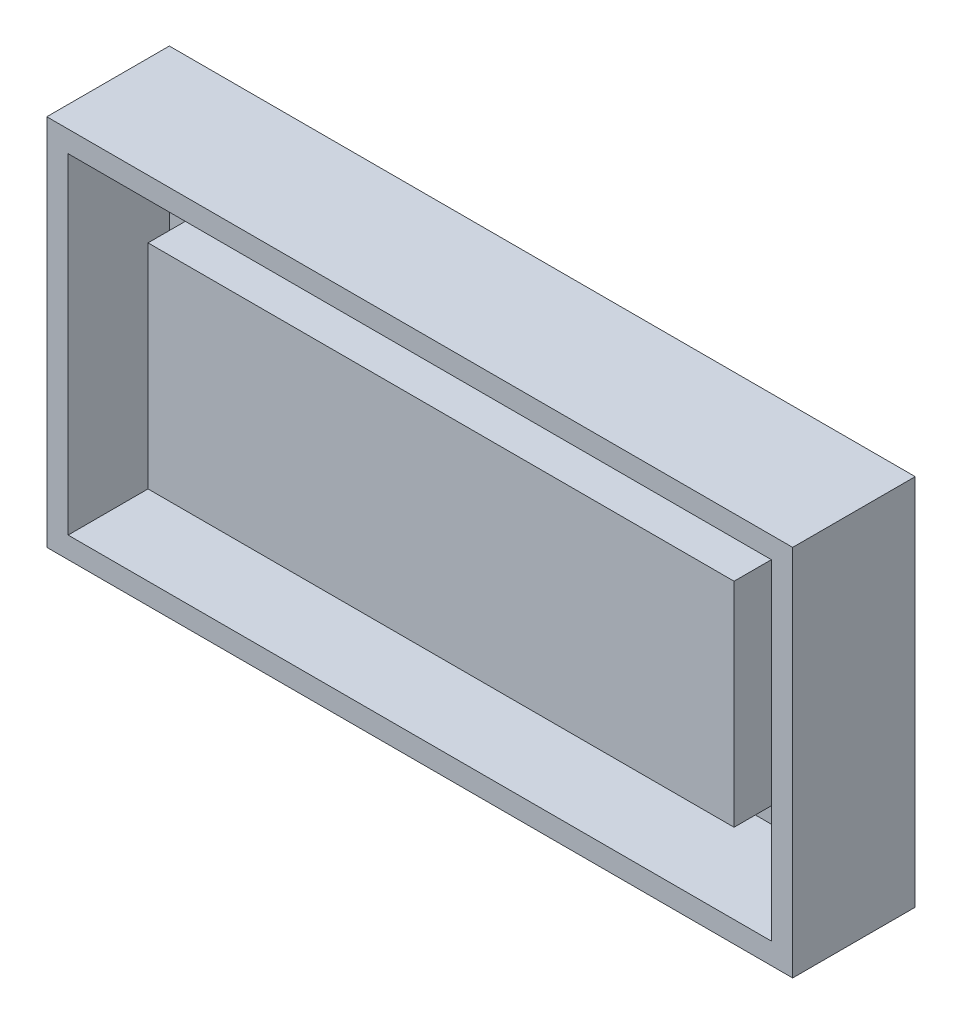
from build123d import *

# Parameters (mm, degrees)
SKETCH1_W           = 70
SKETCH1_H           = 35
BOSS_EXTRUDE1_DEPTH = 2
SKETCH1_3_W         = 70
SKETCH1_3_H         = 35
SKETCH1_3_W_2       = 66
SKETCH1_3_H_2       = 31
BOSS_EXTRUDE2_DEPTH = 9.5
SKETCH1_4_W         = 55
SKETCH1_4_H         = 20
BOSS_EXTRUDE3_DEPTH = 7.5


with BuildPart() as part:
    # Sketch1 → Boss-Extrude1 (new body)
    with BuildSketch(Plane.XY):
        Rectangle(SKETCH1_W, SKETCH1_H)
    extrude(amount=-BOSS_EXTRUDE1_DEPTH)

    # Sketch1<3> → Boss-Extrude2 (add)
    with BuildSketch(Plane.XY):
        Rectangle(SKETCH1_3_W, SKETCH1_3_H)
        Rectangle(SKETCH1_3_W_2, SKETCH1_3_H_2, mode=Mode.SUBTRACT)
    extrude(amount=BOSS_EXTRUDE2_DEPTH)

    # Sketch1<4> → Boss-Extrude3 (add)
    with BuildSketch(Plane.XY):
        Rectangle(SKETCH1_4_W, SKETCH1_4_H)
    extrude(amount=BOSS_EXTRUDE3_DEPTH)


solid = part.part
